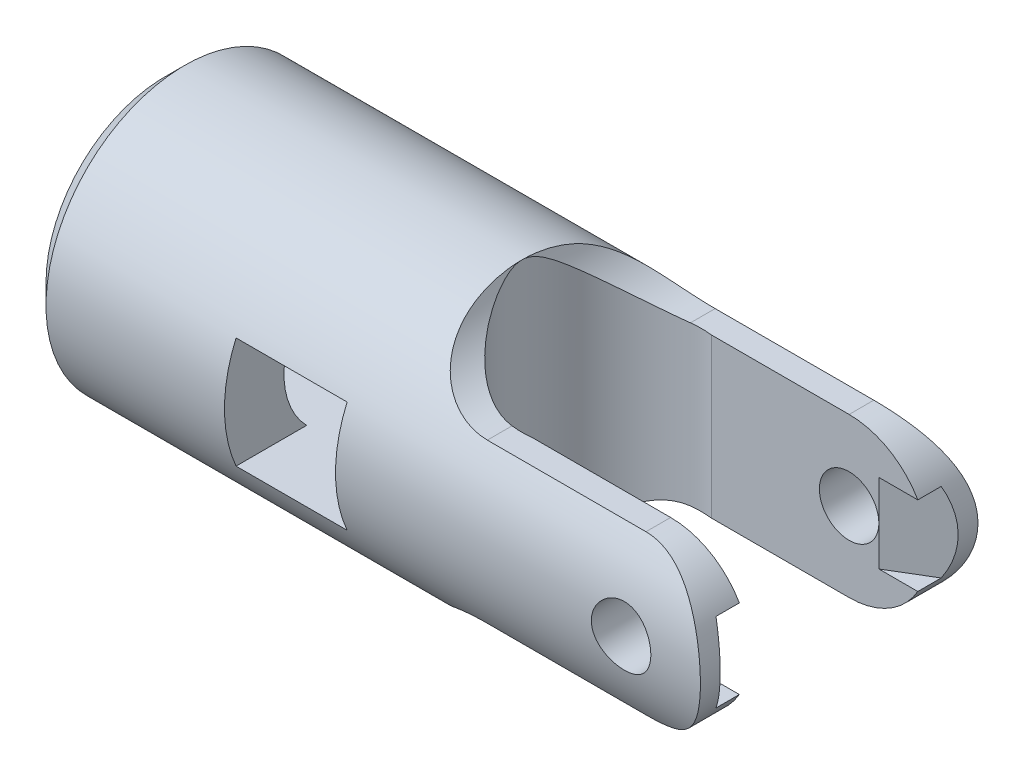
from build123d import *

# Parameters (mm, degrees)
SKETCH_1_R                           = 3.5
EXTRUDE_1_DEPTH                      = 17
CUT_EXTRUDE_START                    = -6
CUT_EXTRUDE_2_DEPTH                  = 6
CUT_EXTRUDE_3_REACH                  = 19.706
CUT_EXTRUDE_3_DIRECTION_2_REACH      = 19.706
CUT_EXTRUDE_4_REACH                  = 19.706
SKETCH_4_R                           = 0.75
CUT_EXTRUDE_4_DIRECTION_2_REACH      = 19.706
CUT_EXTRUDE_START_2                  = -3.500001
SKETCH_5_R                           = 2.265625
CUT_EXTRUDE_5_DEPTH                  = 7.000001
CUT_EXTRUDE_6_REACH                  = 19.706
SKETCH_6_R                           = 2.083333333
CUT_EXTRUDE_6_DIRECTION_2_REACH      = 19.706
CUT_EXTRUDE_7_REACH                  = 19.706
CUT_EXTRUDE_7_END_RADIUS             = 3.5
SKETCH_7_W                           = 2.8
SKETCH_7_H                           = 2.8
CUT_EXTRUDE_7_DIRECTION_2_REACH      = 19.706
CUT_EXTRUDE_7_DIRECTION_2_END_RADIUS = 3.5
CUT_EXTRUDE_8_REACH                  = 19.706
CHAMFER_1_SIZE                       = 0.5
CUT_EXTRUDE_9_DEPTH                  = 1


with BuildPart() as part:
    # 草图1 → 凸台-拉伸1 (new body)
    with BuildSketch(Plane(origin=(0, 0, 0), x_dir=(0, 0, -1), z_dir=(1, 0, 0))):
        Circle(SKETCH_1_R)
    extrude(amount=EXTRUDE_1_DEPTH)

    # 草图2 → 切除-拉伸2 (cut)
    with BuildSketch(Plane(origin=(17, 0, 0), x_dir=(0, 0, -1), z_dir=(1, 0, 0)).offset(CUT_EXTRUDE_START)):
        with BuildLine():
            Line((-2.872281323, -2), (-2.25, -2))
            Line((-2.25, -2), (-2.25, 2))
            Line((-2.25, 2), (-2.872281323, 2))
            ThreePointArc((-2.872281323, 2), (0, 3.5), (2.872281323, 2))
            Line((2.872281323, 2), (2.25, 2))
            Line((2.25, 2), (2.25, -2))
            Line((2.25, -2), (2.872281323, -2))
            ThreePointArc((2.872281323, -2), (0, -3.5), (-2.872281323, -2))
        make_face()
    extrude(amount=CUT_EXTRUDE_2_DEPTH, mode=Mode.SUBTRACT)

    # 草图3 → 切除-拉伸3 (cut, up to next)
    with BuildSketch(Plane.XY, mode=Mode.PRIVATE) as cut_extrude_3_sk1:
        with BuildLine():
            Line((15, 2), (17, 2))
            Line((17, 2), (17, 0))
            ThreePointArc((17, 0), (16.414213562, 1.414213562), (15, 2))
        make_face()
    cut_extrude_3_tool1 = extrude(cut_extrude_3_sk1.sketch, amount=-CUT_EXTRUDE_3_REACH, mode=Mode.PRIVATE) & part.part
    cut_extrude_3 = cut_extrude_3_tool1.solids().sort_by_distance((16.553264, 1.553264, 0))[0]
    add(cut_extrude_3, mode=Mode.SUBTRACT)

    # 草图3 → 切除-拉伸3 direction 2 (cut, up to next)
    with BuildSketch(Plane.XY, mode=Mode.PRIVATE) as cut_extrude_3_direction_2_sk1:
        with BuildLine():
            Line((15, 2), (17, 2))
            Line((17, 2), (17, 0))
            ThreePointArc((17, 0), (16.414213562, 1.414213562), (15, 2))
        make_face()
    cut_extrude_3_direction_2_tool1 = extrude(cut_extrude_3_direction_2_sk1.sketch, amount=CUT_EXTRUDE_3_DIRECTION_2_REACH, mode=Mode.PRIVATE) & part.part
    cut_extrude_3_direction_2 = cut_extrude_3_direction_2_tool1.solids().sort_by_distance((16.553264, 1.553264, 0))[0]
    add(cut_extrude_3_direction_2, mode=Mode.SUBTRACT)

    # 镜向1: 切除-拉伸3, 切除-拉伸3 direction 2 across plane
    add(cut_extrude_3.mirror(Plane.ZX), mode=Mode.SUBTRACT)
    add(cut_extrude_3_direction_2.mirror(Plane.ZX), mode=Mode.SUBTRACT)

    # 草图4 → 切除-拉伸4 (cut, up to next)
    with BuildSketch(Plane.XY, mode=Mode.PRIVATE) as cut_extrude_4_sk1:
        with Locations(Location((15, 0, 0), (0, 0, 180))):
            Circle(SKETCH_4_R)
    cut_extrude_4_tool1 = extrude(cut_extrude_4_sk1.sketch, amount=-CUT_EXTRUDE_4_REACH, mode=Mode.PRIVATE) & part.part
    add(cut_extrude_4_tool1.solids().sort_by_distance((15, 0, 0))[0], mode=Mode.SUBTRACT)

    # 草图4 → 切除-拉伸4 direction 2 (cut, up to next)
    with BuildSketch(Plane.XY, mode=Mode.PRIVATE) as cut_extrude_4_direction_2_sk1:
        with Locations(Location((15, 0, 0), (0, 0, 180))):
            Circle(SKETCH_4_R)
    cut_extrude_4_direction_2_tool1 = extrude(cut_extrude_4_direction_2_sk1.sketch, amount=CUT_EXTRUDE_4_DIRECTION_2_REACH, mode=Mode.PRIVATE) & part.part
    add(cut_extrude_4_direction_2_tool1.solids().sort_by_distance((15, 0, 0))[0], mode=Mode.SUBTRACT)

    # 草图5 → 切除-拉伸5 (cut)
    with BuildSketch(Plane(origin=(0, 0, 0), x_dir=(1, 0, 0), z_dir=(0, 1, 0)).offset(CUT_EXTRUDE_START_2)):
        with Locations((11.265625, 0)):
            Circle(SKETCH_5_R)
    extrude(amount=CUT_EXTRUDE_5_DEPTH, mode=Mode.SUBTRACT)

    # 草图6 → 切除-拉伸6 (cut, up to next)
    with BuildSketch(Plane.XY, mode=Mode.PRIVATE) as cut_extrude_6_sk1:
        with Locations((11, 4.083333333)):
            Circle(SKETCH_6_R)
    cut_extrude_6_tool1 = extrude(cut_extrude_6_sk1.sketch, amount=-CUT_EXTRUDE_6_REACH, mode=Mode.PRIVATE) & part.part
    cut_extrude_6 = cut_extrude_6_tool1.solids().sort_by_distance((11, 4.083333, 0))[0]
    add(cut_extrude_6, mode=Mode.SUBTRACT)

    # 草图6 → 切除-拉伸6 direction 2 (cut, up to next)
    with BuildSketch(Plane.XY, mode=Mode.PRIVATE) as cut_extrude_6_direction_2_sk1:
        with Locations((11, 4.083333333)):
            Circle(SKETCH_6_R)
    cut_extrude_6_direction_2_tool1 = extrude(cut_extrude_6_direction_2_sk1.sketch, amount=CUT_EXTRUDE_6_DIRECTION_2_REACH, mode=Mode.PRIVATE) & part.part
    cut_extrude_6_direction_2 = cut_extrude_6_direction_2_tool1.solids().sort_by_distance((11, 4.083333, 0))[0]
    add(cut_extrude_6_direction_2, mode=Mode.SUBTRACT)

    # 镜向2: 切除-拉伸6, 切除-拉伸6 direction 2 across plane
    add(cut_extrude_6.mirror(Plane.ZX), mode=Mode.SUBTRACT)
    add(cut_extrude_6_direction_2.mirror(Plane.ZX), mode=Mode.SUBTRACT)

    # 切除-拉伸7: up to this cylinder (the profile starts inside it)
    cut_extrude_7_end = Plane(origin=(6.4, 0, 0), z_dir=(-1, 0, 0)) * Cylinder(CUT_EXTRUDE_7_END_RADIUS, 47.412, mode=Mode.PRIVATE)
    # 草图7 → 切除-拉伸7 (cut, up to the surface)
    with BuildSketch(Plane.XY, mode=Mode.PRIVATE) as cut_extrude_7_sk1:
        with Locations((6.4, 0)):
            Rectangle(SKETCH_7_W, SKETCH_7_H)
    cut_extrude_7_tool1 = extrude(cut_extrude_7_sk1.sketch, amount=-CUT_EXTRUDE_7_REACH, mode=Mode.PRIVATE) & cut_extrude_7_end
    add(cut_extrude_7_tool1.solids().sort_by_distance((6.4, 0, 0))[0], mode=Mode.SUBTRACT)

    # 切除-拉伸7 direction 2: up to this cylinder (the profile starts inside it)
    cut_extrude_7_direction_2_end = Plane(origin=(6.4, 0, 0), z_dir=(-1, 0, 0)) * Cylinder(CUT_EXTRUDE_7_DIRECTION_2_END_RADIUS, 47.412, mode=Mode.PRIVATE)
    # 草图7 → 切除-拉伸7 direction 2 (cut, up to the surface)
    with BuildSketch(Plane.XY, mode=Mode.PRIVATE) as cut_extrude_7_direction_2_sk1:
        with Locations((6.4, 0)):
            Rectangle(SKETCH_7_W, SKETCH_7_H)
    cut_extrude_7_direction_2_tool1 = extrude(cut_extrude_7_direction_2_sk1.sketch, amount=CUT_EXTRUDE_7_DIRECTION_2_REACH, mode=Mode.PRIVATE) & cut_extrude_7_direction_2_end
    add(cut_extrude_7_direction_2_tool1.solids().sort_by_distance((6.4, 0, 0))[0], mode=Mode.SUBTRACT)

    # 草图8 → 切除-拉伸8 (cut, up to next)
    with BuildSketch(Plane.ZY, mode=Mode.PRIVATE) as cut_extrude_8_sk1:
        with BuildLine():
            Line((-1.428285686, -1.4), (1.428285686, -1.4))
            ThreePointArc((1.428285686, -1.4), (2, 0), (1.428285686, 1.4))
            Line((1.428285686, 1.4), (-1.428285686, 1.4))
            ThreePointArc((-1.428285686, 1.4), (-2, 0), (-1.428285686, -1.4))
        make_face()
    cut_extrude_8_tool1 = extrude(cut_extrude_8_sk1.sketch, amount=-CUT_EXTRUDE_8_REACH, mode=Mode.PRIVATE) & part.part
    add(cut_extrude_8_tool1.solids().sort_by_distance((0, 0, 0))[0], mode=Mode.SUBTRACT)

    # 倒角1
    chamfer_1_edges = [part.edges().sort_by_distance(p)[0] for p in [
        (0, 0, -2),
        (0, -1.4, 0),
        (0, 0, 2),
        (0, 1.4, 0),
        (0, 0, 3.5),
    ]]
    chamfer(chamfer_1_edges, length=CHAMFER_1_SIZE)

    # 草图9 → 切除-拉伸9 (cut, symmetric)
    with BuildSketch(Plane(origin=(0, 0, 0), x_dir=(1, 0, 0), z_dir=(0, 1, 0))):
        Polygon((17, 2.25), (15.75, 2.25), (17, 3), align=None)
    cut_extrude_9 = extrude(amount=CUT_EXTRUDE_9_DEPTH, both=True, mode=Mode.SUBTRACT)

    # 镜向3: 切除-拉伸9 across plane
    add(cut_extrude_9.mirror(Plane.XY), mode=Mode.SUBTRACT)


solid = part.part
